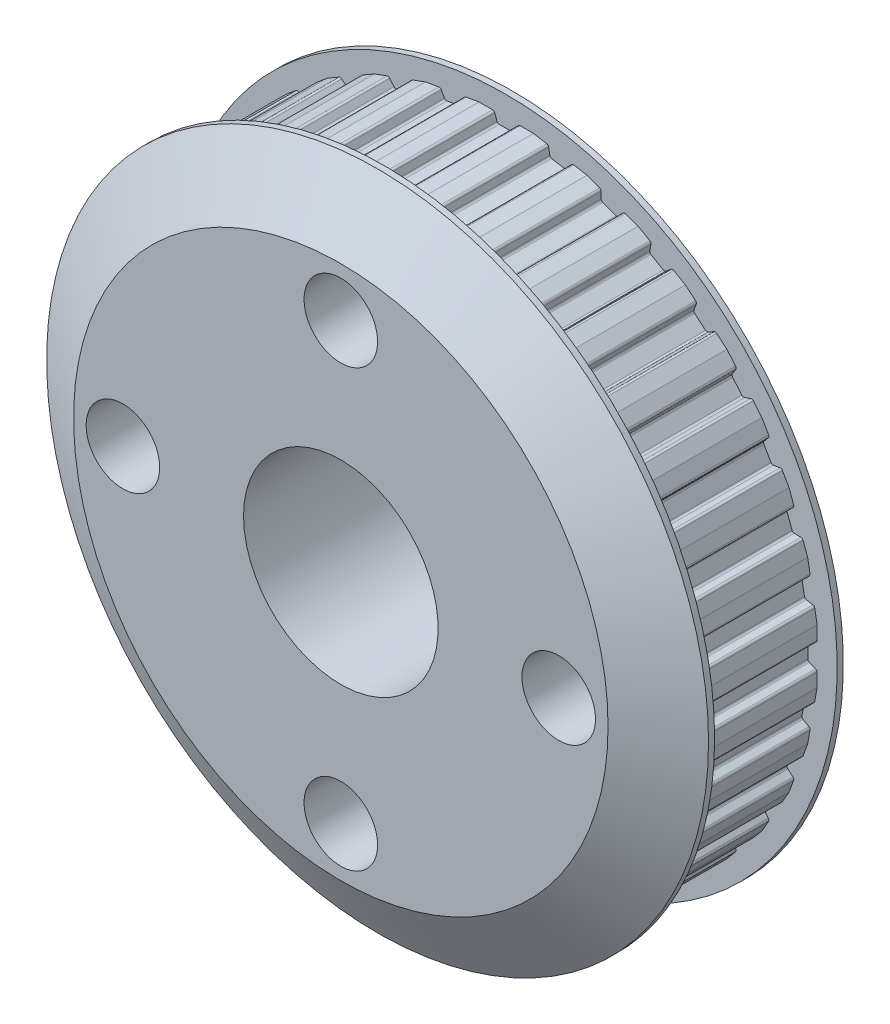
from build123d import *

# Parameters (mm, degrees)
BOSS_EXTRUDE1_DEPTH         = 5
SKETCH3_R                   = 13.5
BOSS_EXTRUDE2_DEPTH         = 1.75
BOSS_EXTRUDE3_START         = 1.75
SKETCH4_R                   = 13.5
BOSS_EXTRUDE3_DEPTH         = 1.75
F_5_16_0_3125_DOWEL_HOLE2_D = 7.9375
F_3_0MM_DOWEL_HOLE1_D       = 3
CIRPATTERN1_COUNT           = 4
CHAMFER1_SIZE               = 1.5
CHAMFER1_SIZE2              = 2.598076211
CHAMFER2_SIZE               = 1.5
CHAMFER2_SIZE2              = 2.598076211


with BuildPart() as part:
    # Sketch1 → Boss-Extrude1 (new body)
    with BuildSketch(Plane.XY):
        with BuildLine():
            Line((-50.893410658, 0.019378156), (-50.349150357, 0.019378156))
            ThreePointArc((-50.349150357, 0.019378156), (-50.294517201, 0.036603923), (-50.259644635, 0.082050737))
            Line((-50.259644635, 0.082050737), (-50.166593884, 0.337705574))
            ThreePointArc((-50.166593884, 0.337705574), (-50.131721317, 0.383152388), (-50.077088162, 0.400378156))
            Line((-50.077088162, 0.400378156), (-49.495946241, 0.400378156))
            ThreePointArc((-49.495946241, 0.400378156), (-49.441313085, 0.383152388), (-49.406440519, 0.337705574))
            Line((-49.406440519, 0.337705574), (-49.313389768, 0.082050737))
            ThreePointArc((-49.313389768, 0.082050737), (-49.278517201, 0.036603923), (-49.223884046, 0.019378156))
            Line((-49.223884046, 0.019378156), (-48.674589342, 0.019378156))
            Line((-48.674589342, 0.019378156), (-48.138597578, 0.113887965))
            ThreePointArc((-48.138597578, 0.113887965), (-48.087785646, 0.140338983), (-48.061334629, 0.191150915))
            Line((-48.061334629, 0.191150915), (-48.014091524, 0.459079874))
            ThreePointArc((-48.014091524, 0.459079874), (-47.987640507, 0.509891806), (-47.936828575, 0.536342823))
            Line((-47.936828575, 0.536342823), (-47.364515506, 0.637257059))
            ThreePointArc((-47.364515506, 0.637257059), (-47.307721127, 0.629779937), (-47.265486597, 0.59107912))
            Line((-47.265486597, 0.59107912), (-47.129455499, 0.355466348))
            ThreePointArc((-47.129455499, 0.355466348), (-47.087220969, 0.316765531), (-47.030426591, 0.309288409))
            Line((-47.030426591, 0.309288409), (-46.489476908, 0.404672434))
            Line((-46.489476908, 0.404672434), (-45.978039519, 0.59082042))
            ThreePointArc((-45.978039519, 0.59082042), (-45.932592706, 0.625692986), (-45.915366938, 0.680326142))
            Line((-45.915366938, 0.680326142), (-45.915366938, 0.952388337))
            ThreePointArc((-45.915366938, 0.952388337), (-45.89814117, 1.007021493), (-45.852694357, 1.041894059))
            Line((-45.852694357, 1.041894059), (-45.306599582, 1.240656302))
            ThreePointArc((-45.306599582, 1.240656302), (-45.24936965, 1.243155015), (-45.20105643, 1.2123761))
            Line((-45.20105643, 1.2123761), (-45.026178222, 1.003964367))
            ThreePointArc((-45.026178222, 1.003964367), (-44.977865003, 0.973185452), (-44.92063507, 0.975684165))
            Line((-44.92063507, 0.975684165), (-44.404466891, 1.163554018))
            Line((-44.404466891, 1.163554018), (-43.933123644, 1.435684168))
            ThreePointArc((-43.933123644, 1.435684168), (-43.894422827, 1.477918699), (-43.886945705, 1.534713077))
            Line((-43.886945705, 1.534713077), (-43.93418881, 1.802642036))
            ThreePointArc((-43.93418881, 1.802642036), (-43.926711688, 1.859436415), (-43.888010871, 1.901670945))
            Line((-43.888010871, 1.901670945), (-43.384727205, 2.192241905))
            ThreePointArc((-43.384727205, 2.192241905), (-43.32880062, 2.204640531), (-43.275876685, 2.182718719))
            Line((-43.275876685, 2.182718719), (-43.067464952, 2.007840511))
            ThreePointArc((-43.067464952, 2.007840511), (-43.014541017, 1.985918699), (-42.958614432, 1.998317324))
            Line((-42.958614432, 1.998317324), (-42.482911265, 2.272964676))
            Line((-42.482911265, 2.272964676), (-42.065983686, 2.622808454))
            ThreePointArc((-42.065983686, 2.622808454), (-42.035204771, 2.671121673), (-42.037703483, 2.728351606))
            Line((-42.037703483, 2.728351606), (-42.130754234, 2.984006443))
            ThreePointArc((-42.130754234, 2.984006443), (-42.133252947, 3.041236376), (-42.102474032, 3.089549595))
            Line((-42.102474032, 3.089549595), (-41.657293493, 3.463100421))
            ThreePointArc((-41.657293493, 3.463100421), (-41.604369558, 3.485022233), (-41.548442973, 3.472623607))
            Line((-41.548442973, 3.472623607), (-41.312830201, 3.33659251))
            ThreePointArc((-41.312830201, 3.33659251), (-41.256903616, 3.324193884), (-41.203979681, 3.346115696))
            Line((-41.203979681, 3.346115696), (-40.783195526, 3.699195526))
            Line((-40.783195526, 3.699195526), (-40.433351748, 4.116123105))
            ThreePointArc((-40.433351748, 4.116123105), (-40.411429936, 4.16904704), (-40.423828561, 4.224973625))
            Line((-40.423828561, 4.224973625), (-40.559859659, 4.460586397))
            ThreePointArc((-40.559859659, 4.460586397), (-40.572258284, 4.516512982), (-40.550336472, 4.569436917))
            Line((-40.550336472, 4.569436917), (-40.176785646, 5.014617456))
            ThreePointArc((-40.176785646, 5.014617456), (-40.128472427, 5.045396371), (-40.071242495, 5.042897658))
            Line((-40.071242495, 5.042897658), (-39.815587657, 4.949846907))
            ThreePointArc((-39.815587657, 4.949846907), (-39.758357725, 4.947348194), (-39.710044505, 4.978127109))
            Line((-39.710044505, 4.978127109), (-39.356964676, 5.398911265))
            Line((-39.356964676, 5.398911265), (-39.084834525, 5.870254512))
            ThreePointArc((-39.084834525, 5.870254512), (-39.0724359, 5.926181096), (-39.094357712, 5.979105032))
            Line((-39.094357712, 5.979105032), (-39.26923592, 6.187516764))
            ThreePointArc((-39.26923592, 6.187516764), (-39.291157732, 6.2404407), (-39.278759107, 6.296367284))
            Line((-39.278759107, 6.296367284), (-38.988188146, 6.799650951))
            ThreePointArc((-38.988188146, 6.799650951), (-38.945953616, 6.838351767), (-38.889159238, 6.845828889))
            Line((-38.889159238, 6.845828889), (-38.621230278, 6.798585785))
            ThreePointArc((-38.621230278, 6.798585785), (-38.5644359, 6.806062906), (-38.52220137, 6.844763723))
            Line((-38.52220137, 6.844763723), (-38.247554018, 7.320466891))
            Line((-38.247554018, 7.320466891), (-38.061406032, 7.831904279))
            ThreePointArc((-38.061406032, 7.831904279), (-38.058907319, 7.889134212), (-38.089686234, 7.937447431))
            Line((-38.089686234, 7.937447431), (-38.298097967, 8.112325639))
            ThreePointArc((-38.298097967, 8.112325639), (-38.328876882, 8.160638859), (-38.326378169, 8.217868791))
            Line((-38.326378169, 8.217868791), (-38.127615926, 8.763963566))
            ThreePointArc((-38.127615926, 8.763963566), (-38.09274336, 8.809410379), (-38.038110204, 8.826636147))
            Line((-38.038110204, 8.826636147), (-37.766048009, 8.826636147))
            ThreePointArc((-37.766048009, 8.826636147), (-37.711414853, 8.843861915), (-37.676542287, 8.889308728))
            Line((-37.676542287, 8.889308728), (-37.488672434, 9.405476908))
            Line((-37.488672434, 9.405476908), (-37.394162624, 9.941468672))
            ThreePointArc((-37.394162624, 9.941468672), (-37.401639746, 9.99826305), (-37.440340563, 10.040497581))
            Line((-37.440340563, 10.040497581), (-37.675953335, 10.176528678))
            ThreePointArc((-37.675953335, 10.176528678), (-37.714654152, 10.218763208), (-37.722131274, 10.275557587))
            Line((-37.722131274, 10.275557587), (-37.621217038, 10.847870656))
            ThreePointArc((-37.621217038, 10.847870656), (-37.594766021, 10.898682588), (-37.543954089, 10.925133605))
            Line((-37.543954089, 10.925133605), (-37.276025129, 10.97237671))
            ThreePointArc((-37.276025129, 10.97237671), (-37.225213197, 10.998827727), (-37.19876218, 11.049639659))
            Line((-37.19876218, 11.049639659), (-37.103378156, 11.590589342))
            Line((-37.103378156, 11.590589342), (-37.103378156, 12.134849643))
            ThreePointArc((-37.103378156, 12.134849643), (-37.120603923, 12.189482799), (-37.166050737, 12.224355365))
            Line((-37.166050737, 12.224355365), (-37.421705574, 12.317406116))
            ThreePointArc((-37.421705574, 12.317406116), (-37.467152388, 12.352278683), (-37.484378156, 12.406911838))
            Line((-37.484378156, 12.406911838), (-37.484378156, 12.988053759))
            ThreePointArc((-37.484378156, 12.988053759), (-37.467152388, 13.042686915), (-37.421705574, 13.077559481))
            Line((-37.421705574, 13.077559481), (-37.166050737, 13.170610232))
            ThreePointArc((-37.166050737, 13.170610232), (-37.120603923, 13.205482799), (-37.103378156, 13.260115954))
            Line((-37.103378156, 13.260115954), (-37.103378156, 13.809410658))
            Line((-37.103378156, 13.809410658), (-37.197887965, 14.345402422))
            ThreePointArc((-37.197887965, 14.345402422), (-37.224338983, 14.396214354), (-37.275150915, 14.422665371))
            Line((-37.275150915, 14.422665371), (-37.543079874, 14.469908476))
            ThreePointArc((-37.543079874, 14.469908476), (-37.593891806, 14.496359493), (-37.620342823, 14.547171425))
            Line((-37.620342823, 14.547171425), (-37.721257059, 15.119484494))
            ThreePointArc((-37.721257059, 15.119484494), (-37.713779937, 15.176278873), (-37.67507912, 15.218513403))
            Line((-37.67507912, 15.218513403), (-37.439466348, 15.354544501))
            ThreePointArc((-37.439466348, 15.354544501), (-37.400765531, 15.396779031), (-37.393288409, 15.453573409))
            Line((-37.393288409, 15.453573409), (-37.488672434, 15.994523092))
            Line((-37.488672434, 15.994523092), (-37.67482042, 16.505960481))
            ThreePointArc((-37.67482042, 16.505960481), (-37.709692986, 16.551407294), (-37.764326142, 16.568633062))
            Line((-37.764326142, 16.568633062), (-38.036388337, 16.568633062))
            ThreePointArc((-38.036388337, 16.568633062), (-38.091021493, 16.58585883), (-38.125894059, 16.631305643))
            Line((-38.125894059, 16.631305643), (-38.324656302, 17.177400418))
            ThreePointArc((-38.324656302, 17.177400418), (-38.327155015, 17.23463035), (-38.2963761, 17.28294357))
            Line((-38.2963761, 17.28294357), (-38.087964367, 17.457821778))
            ThreePointArc((-38.087964367, 17.457821778), (-38.057185452, 17.506134997), (-38.059684165, 17.56336493))
            Line((-38.059684165, 17.56336493), (-38.247554018, 18.079533109))
            Line((-38.247554018, 18.079533109), (-38.519684168, 18.550876356))
            ThreePointArc((-38.519684168, 18.550876356), (-38.561918699, 18.589577173), (-38.618713077, 18.597054295))
            Line((-38.618713077, 18.597054295), (-38.886642036, 18.54981119))
            ThreePointArc((-38.886642036, 18.54981119), (-38.943436415, 18.557288312), (-38.985670945, 18.595989129))
            Line((-38.985670945, 18.595989129), (-39.276241905, 19.099272795))
            ThreePointArc((-39.276241905, 19.099272795), (-39.288640531, 19.15519938), (-39.266718719, 19.208123315))
            Line((-39.266718719, 19.208123315), (-39.091840511, 19.416535048))
            ThreePointArc((-39.091840511, 19.416535048), (-39.069918699, 19.469458983), (-39.082317324, 19.525385568))
            Line((-39.082317324, 19.525385568), (-39.356964676, 20.001088735))
            Line((-39.356964676, 20.001088735), (-39.706808454, 20.418016314))
            ThreePointArc((-39.706808454, 20.418016314), (-39.755121673, 20.448795229), (-39.812351606, 20.446296517))
            Line((-39.812351606, 20.446296517), (-40.068006443, 20.353245766))
            ThreePointArc((-40.068006443, 20.353245766), (-40.125236376, 20.350747053), (-40.173549595, 20.381525968))
            Line((-40.173549595, 20.381525968), (-40.547100421, 20.826706507))
            ThreePointArc((-40.547100421, 20.826706507), (-40.569022233, 20.879630442), (-40.556623607, 20.935557027))
            Line((-40.556623607, 20.935557027), (-40.42059251, 21.171169799))
            ThreePointArc((-40.42059251, 21.171169799), (-40.408193884, 21.227096384), (-40.430115696, 21.280020319))
            Line((-40.430115696, 21.280020319), (-40.783195526, 21.700804474))
            Line((-40.783195526, 21.700804474), (-41.200123105, 22.050648252))
            ThreePointArc((-41.200123105, 22.050648252), (-41.25304704, 22.072570064), (-41.308973625, 22.060171439))
            Line((-41.308973625, 22.060171439), (-41.544586397, 21.924140341))
            ThreePointArc((-41.544586397, 21.924140341), (-41.600512982, 21.911741716), (-41.653436917, 21.933663528))
            Line((-41.653436917, 21.933663528), (-42.098617456, 22.307214354))
            ThreePointArc((-42.098617456, 22.307214354), (-42.129396371, 22.355527573), (-42.126897658, 22.412757505))
            Line((-42.126897658, 22.412757505), (-42.033846907, 22.668412343))
            ThreePointArc((-42.033846907, 22.668412343), (-42.031348194, 22.725642275), (-42.062127109, 22.773955495))
            Line((-42.062127109, 22.773955495), (-42.482911265, 23.127035324))
            Line((-42.482911265, 23.127035324), (-42.954254512, 23.399165475))
            ThreePointArc((-42.954254512, 23.399165475), (-43.010181096, 23.4115641), (-43.063105032, 23.389642288))
            Line((-43.063105032, 23.389642288), (-43.271516764, 23.21476408))
            ThreePointArc((-43.271516764, 23.21476408), (-43.3244407, 23.192842268), (-43.380367284, 23.205240893))
            Line((-43.380367284, 23.205240893), (-43.883650951, 23.495811854))
            ThreePointArc((-43.883650951, 23.495811854), (-43.922351767, 23.538046384), (-43.929828889, 23.594840762))
            Line((-43.929828889, 23.594840762), (-43.882585785, 23.862769722))
            ThreePointArc((-43.882585785, 23.862769722), (-43.890062906, 23.9195641), (-43.928763723, 23.96179863))
            Line((-43.928763723, 23.96179863), (-44.404466891, 24.236445982))
            Line((-44.404466891, 24.236445982), (-44.915904279, 24.422593968))
            ThreePointArc((-44.915904279, 24.422593968), (-44.973134212, 24.425092681), (-45.021447431, 24.394313766))
            Line((-45.021447431, 24.394313766), (-45.196325639, 24.185902033))
            ThreePointArc((-45.196325639, 24.185902033), (-45.244638859, 24.155123118), (-45.301868791, 24.157621831))
            Line((-45.301868791, 24.157621831), (-45.847963566, 24.356384074))
            ThreePointArc((-45.847963566, 24.356384074), (-45.893410379, 24.39125664), (-45.910636147, 24.445889796))
            Line((-45.910636147, 24.445889796), (-45.910636147, 24.717951991))
            ThreePointArc((-45.910636147, 24.717951991), (-45.927861915, 24.772585147), (-45.973308728, 24.807457713))
            Line((-45.973308728, 24.807457713), (-46.489476908, 24.995327566))
            Line((-46.489476908, 24.995327566), (-47.025468672, 25.089837376))
            ThreePointArc((-47.025468672, 25.089837376), (-47.08226305, 25.082360254), (-47.124497581, 25.043659437))
            Line((-47.124497581, 25.043659437), (-47.260528678, 24.808046665))
            ThreePointArc((-47.260528678, 24.808046665), (-47.302763208, 24.769345848), (-47.359557587, 24.761868726))
            Line((-47.359557587, 24.761868726), (-47.931870656, 24.862782962))
            ThreePointArc((-47.931870656, 24.862782962), (-47.982682588, 24.889233979), (-48.009133605, 24.940045911))
            Line((-48.009133605, 24.940045911), (-48.05637671, 25.207974871))
            ThreePointArc((-48.05637671, 25.207974871), (-48.082827727, 25.258786803), (-48.133639659, 25.28523782))
            Line((-48.133639659, 25.28523782), (-48.674589342, 25.380621844))
            Line((-48.674589342, 25.380621844), (-49.218849643, 25.380621844))
            ThreePointArc((-49.218849643, 25.380621844), (-49.273482799, 25.363396077), (-49.308355365, 25.317949263))
            Line((-49.308355365, 25.317949263), (-49.401406116, 25.062294426))
            ThreePointArc((-49.401406116, 25.062294426), (-49.436278683, 25.016847612), (-49.490911838, 24.999621844))
            Line((-49.490911838, 24.999621844), (-50.072053759, 24.999621844))
            ThreePointArc((-50.072053759, 24.999621844), (-50.126686915, 25.016847612), (-50.161559481, 25.062294426))
            Line((-50.161559481, 25.062294426), (-50.254610232, 25.317949263))
            ThreePointArc((-50.254610232, 25.317949263), (-50.289482799, 25.363396077), (-50.344115954, 25.380621844))
            Line((-50.344115954, 25.380621844), (-50.893410658, 25.380621844))
            Line((-50.893410658, 25.380621844), (-51.429402422, 25.286112035))
            ThreePointArc((-51.429402422, 25.286112035), (-51.480214354, 25.259661017), (-51.506665371, 25.208849085))
            Line((-51.506665371, 25.208849085), (-51.553908476, 24.940920126))
            ThreePointArc((-51.553908476, 24.940920126), (-51.580359493, 24.890108194), (-51.631171425, 24.863657177))
            Line((-51.631171425, 24.863657177), (-52.203484494, 24.762742941))
            ThreePointArc((-52.203484494, 24.762742941), (-52.260278873, 24.770220063), (-52.302513403, 24.80892088))
            Line((-52.302513403, 24.80892088), (-52.438544501, 25.044533652))
            ThreePointArc((-52.438544501, 25.044533652), (-52.480779031, 25.083234469), (-52.537573409, 25.090711591))
            Line((-52.537573409, 25.090711591), (-53.078523092, 24.995327566))
            Line((-53.078523092, 24.995327566), (-53.589960481, 24.80917958))
            ThreePointArc((-53.589960481, 24.80917958), (-53.635407294, 24.774307014), (-53.652633062, 24.719673858))
            Line((-53.652633062, 24.719673858), (-53.652633062, 24.447611663))
            ThreePointArc((-53.652633062, 24.447611663), (-53.66985883, 24.392978507), (-53.715305643, 24.358105941))
            Line((-53.715305643, 24.358105941), (-54.261400418, 24.159343698))
            ThreePointArc((-54.261400418, 24.159343698), (-54.31863035, 24.156844985), (-54.36694357, 24.1876239))
            Line((-54.36694357, 24.1876239), (-54.541821778, 24.396035633))
            ThreePointArc((-54.541821778, 24.396035633), (-54.590134997, 24.426814548), (-54.64736493, 24.424315835))
            Line((-54.64736493, 24.424315835), (-55.163533109, 24.236445982))
            Line((-55.163533109, 24.236445982), (-55.634876356, 23.964315832))
            ThreePointArc((-55.634876356, 23.964315832), (-55.673577173, 23.922081301), (-55.681054295, 23.865286923))
            Line((-55.681054295, 23.865286923), (-55.63381119, 23.597357964))
            ThreePointArc((-55.63381119, 23.597357964), (-55.641288312, 23.540563585), (-55.679989129, 23.498329055))
            Line((-55.679989129, 23.498329055), (-56.183272795, 23.207758095))
            ThreePointArc((-56.183272795, 23.207758095), (-56.23919938, 23.195359469), (-56.292123315, 23.217281281))
            Line((-56.292123315, 23.217281281), (-56.500535048, 23.392159489))
            ThreePointArc((-56.500535048, 23.392159489), (-56.553458983, 23.414081301), (-56.609385568, 23.401682676))
            Line((-56.609385568, 23.401682676), (-57.085088735, 23.127035324))
            Line((-57.085088735, 23.127035324), (-57.502016314, 22.777191546))
            ThreePointArc((-57.502016314, 22.777191546), (-57.532795229, 22.728878327), (-57.530296517, 22.671648394))
            Line((-57.530296517, 22.671648394), (-57.437245766, 22.415993557))
            ThreePointArc((-57.437245766, 22.415993557), (-57.434747053, 22.358763624), (-57.465525968, 22.310450405))
            Line((-57.465525968, 22.310450405), (-57.910706507, 21.936899579))
            ThreePointArc((-57.910706507, 21.936899579), (-57.963630442, 21.914977767), (-58.019557027, 21.927376393))
            Line((-58.019557027, 21.927376393), (-58.255169799, 22.06340749))
            ThreePointArc((-58.255169799, 22.06340749), (-58.311096384, 22.075806116), (-58.364020319, 22.053884304))
            Line((-58.364020319, 22.053884304), (-58.784804474, 21.700804474))
            Line((-58.784804474, 21.700804474), (-59.134648252, 21.283876895))
            ThreePointArc((-59.134648252, 21.283876895), (-59.156570064, 21.23095296), (-59.144171439, 21.175026375))
            Line((-59.144171439, 21.175026375), (-59.008140341, 20.939413603))
            ThreePointArc((-59.008140341, 20.939413603), (-58.995741716, 20.883487018), (-59.017663528, 20.830563083))
            Line((-59.017663528, 20.830563083), (-59.391214354, 20.385382544))
            ThreePointArc((-59.391214354, 20.385382544), (-59.439527573, 20.354603629), (-59.496757505, 20.357102342))
            Line((-59.496757505, 20.357102342), (-59.752412343, 20.450153093))
            ThreePointArc((-59.752412343, 20.450153093), (-59.809642275, 20.452651806), (-59.857955495, 20.421872891))
            Line((-59.857955495, 20.421872891), (-60.211035324, 20.001088735))
            Line((-60.211035324, 20.001088735), (-60.483165475, 19.529745488))
            ThreePointArc((-60.483165475, 19.529745488), (-60.4955641, 19.473818904), (-60.473642288, 19.420894968))
            Line((-60.473642288, 19.420894968), (-60.29876408, 19.212483236))
            ThreePointArc((-60.29876408, 19.212483236), (-60.276842268, 19.1595593), (-60.289240893, 19.103632716))
            Line((-60.289240893, 19.103632716), (-60.579811854, 18.600349049))
            ThreePointArc((-60.579811854, 18.600349049), (-60.622046384, 18.561648233), (-60.678840762, 18.554171111))
            Line((-60.678840762, 18.554171111), (-60.946769722, 18.601414215))
            ThreePointArc((-60.946769722, 18.601414215), (-61.0035641, 18.593937094), (-61.04579863, 18.555236277))
            Line((-61.04579863, 18.555236277), (-61.320445982, 18.079533109))
            Line((-61.320445982, 18.079533109), (-61.506593968, 17.568095721))
            ThreePointArc((-61.506593968, 17.568095721), (-61.509092681, 17.510865788), (-61.478313766, 17.462552569))
            Line((-61.478313766, 17.462552569), (-61.269902033, 17.287674361))
            ThreePointArc((-61.269902033, 17.287674361), (-61.239123118, 17.239361141), (-61.241621831, 17.182131209))
            Line((-61.241621831, 17.182131209), (-61.440384074, 16.636036434))
            ThreePointArc((-61.440384074, 16.636036434), (-61.47525664, 16.590589621), (-61.529889796, 16.573363853))
            Line((-61.529889796, 16.573363853), (-61.801951991, 16.573363853))
            ThreePointArc((-61.801951991, 16.573363853), (-61.856585147, 16.556138085), (-61.891457713, 16.510691272))
            Line((-61.891457713, 16.510691272), (-62.079327566, 15.994523092))
            Line((-62.079327566, 15.994523092), (-62.173837376, 15.458531328))
            ThreePointArc((-62.173837376, 15.458531328), (-62.166360254, 15.40173695), (-62.127659437, 15.359502419))
            Line((-62.127659437, 15.359502419), (-61.892046665, 15.223471322))
            ThreePointArc((-61.892046665, 15.223471322), (-61.853345848, 15.181236792), (-61.845868726, 15.124442413))
            Line((-61.845868726, 15.124442413), (-61.946782962, 14.552129344))
            ThreePointArc((-61.946782962, 14.552129344), (-61.973233979, 14.501317412), (-62.024045911, 14.474866395))
            Line((-62.024045911, 14.474866395), (-62.291974871, 14.42762329))
            ThreePointArc((-62.291974871, 14.42762329), (-62.342786803, 14.401172273), (-62.36923782, 14.350360341))
            Line((-62.36923782, 14.350360341), (-62.464621844, 13.809410658))
            Line((-62.464621844, 13.809410658), (-62.464621844, 13.265150357))
            ThreePointArc((-62.464621844, 13.265150357), (-62.447396077, 13.210517201), (-62.401949263, 13.175644635))
            Line((-62.401949263, 13.175644635), (-62.146294426, 13.082593884))
            ThreePointArc((-62.146294426, 13.082593884), (-62.100847612, 13.047721317), (-62.083621844, 12.993088162))
            Line((-62.083621844, 12.993088162), (-62.083621844, 12.411946241))
            ThreePointArc((-62.083621844, 12.411946241), (-62.100847612, 12.357313085), (-62.146294426, 12.322440519))
            Line((-62.146294426, 12.322440519), (-62.401949263, 12.229389768))
            ThreePointArc((-62.401949263, 12.229389768), (-62.447396077, 12.194517201), (-62.464621844, 12.139884046))
            Line((-62.464621844, 12.139884046), (-62.464621844, 11.590589342))
            Line((-62.464621844, 11.590589342), (-62.370112035, 11.054597578))
            ThreePointArc((-62.370112035, 11.054597578), (-62.343661017, 11.003785646), (-62.292849085, 10.977334629))
            Line((-62.292849085, 10.977334629), (-62.024920126, 10.930091524))
            ThreePointArc((-62.024920126, 10.930091524), (-61.974108194, 10.903640507), (-61.947657177, 10.852828575))
            Line((-61.947657177, 10.852828575), (-61.846742941, 10.280515506))
            ThreePointArc((-61.846742941, 10.280515506), (-61.854220063, 10.223721127), (-61.89292088, 10.181486597))
            Line((-61.89292088, 10.181486597), (-62.128533652, 10.045455499))
            ThreePointArc((-62.128533652, 10.045455499), (-62.167234469, 10.003220969), (-62.174711591, 9.946426591))
            Line((-62.174711591, 9.946426591), (-62.079327566, 9.405476908))
            Line((-62.079327566, 9.405476908), (-61.89317958, 8.894039519))
            ThreePointArc((-61.89317958, 8.894039519), (-61.858307014, 8.848592706), (-61.803673858, 8.831366938))
            Line((-61.803673858, 8.831366938), (-61.531611663, 8.831366938))
            ThreePointArc((-61.531611663, 8.831366938), (-61.476978507, 8.81414117), (-61.442105941, 8.768694357))
            Line((-61.442105941, 8.768694357), (-61.243343698, 8.222599582))
            ThreePointArc((-61.243343698, 8.222599582), (-61.240844985, 8.16536965), (-61.2716239, 8.11705643))
            Line((-61.2716239, 8.11705643), (-61.480035633, 7.942178222))
            ThreePointArc((-61.480035633, 7.942178222), (-61.510814548, 7.893865003), (-61.508315835, 7.83663507))
            Line((-61.508315835, 7.83663507), (-61.320445982, 7.320466891))
            Line((-61.320445982, 7.320466891), (-61.048315832, 6.849123644))
            ThreePointArc((-61.048315832, 6.849123644), (-61.006081301, 6.810422827), (-60.949286923, 6.802945705))
            Line((-60.949286923, 6.802945705), (-60.681357964, 6.85018881))
            ThreePointArc((-60.681357964, 6.85018881), (-60.624563585, 6.842711688), (-60.582329055, 6.804010871))
            Line((-60.582329055, 6.804010871), (-60.291758095, 6.300727205))
            ThreePointArc((-60.291758095, 6.300727205), (-60.279359469, 6.24480062), (-60.301281281, 6.191876685))
            Line((-60.301281281, 6.191876685), (-60.476159489, 5.983464952))
            ThreePointArc((-60.476159489, 5.983464952), (-60.498081301, 5.930541017), (-60.485682676, 5.874614432))
            Line((-60.485682676, 5.874614432), (-60.211035324, 5.398911265))
            Line((-60.211035324, 5.398911265), (-59.861191546, 4.981983686))
            ThreePointArc((-59.861191546, 4.981983686), (-59.812878327, 4.951204771), (-59.755648394, 4.953703483))
            Line((-59.755648394, 4.953703483), (-59.499993557, 5.046754234))
            ThreePointArc((-59.499993557, 5.046754234), (-59.442763624, 5.049252947), (-59.394450405, 5.018474032))
            Line((-59.394450405, 5.018474032), (-59.020899579, 4.573293493))
            ThreePointArc((-59.020899579, 4.573293493), (-58.998977767, 4.520369558), (-59.011376393, 4.464442973))
            Line((-59.011376393, 4.464442973), (-59.14740749, 4.228830201))
            ThreePointArc((-59.14740749, 4.228830201), (-59.159806116, 4.172903616), (-59.137884304, 4.119979681))
            Line((-59.137884304, 4.119979681), (-58.784804474, 3.699195526))
            Line((-58.784804474, 3.699195526), (-58.367876895, 3.349351748))
            ThreePointArc((-58.367876895, 3.349351748), (-58.31495296, 3.327429936), (-58.259026375, 3.339828561))
            Line((-58.259026375, 3.339828561), (-58.023413603, 3.475859659))
            ThreePointArc((-58.023413603, 3.475859659), (-57.967487018, 3.488258284), (-57.914563083, 3.466336472))
            Line((-57.914563083, 3.466336472), (-57.469382544, 3.092785646))
            ThreePointArc((-57.469382544, 3.092785646), (-57.438603629, 3.044472427), (-57.441102342, 2.987242495))
            Line((-57.441102342, 2.987242495), (-57.534153093, 2.731587657))
            ThreePointArc((-57.534153093, 2.731587657), (-57.536651806, 2.674357725), (-57.505872891, 2.626044505))
            Line((-57.505872891, 2.626044505), (-57.085088735, 2.272964676))
            Line((-57.085088735, 2.272964676), (-56.613745488, 2.000834525))
            ThreePointArc((-56.613745488, 2.000834525), (-56.557818904, 1.9884359), (-56.504894968, 2.010357712))
            Line((-56.504894968, 2.010357712), (-56.296483236, 2.18523592))
            ThreePointArc((-56.296483236, 2.18523592), (-56.2435593, 2.207157732), (-56.187632716, 2.194759107))
            Line((-56.187632716, 2.194759107), (-55.684349049, 1.904188146))
            ThreePointArc((-55.684349049, 1.904188146), (-55.645648233, 1.861953616), (-55.638171111, 1.805159238))
            Line((-55.638171111, 1.805159238), (-55.685414215, 1.537230278))
            ThreePointArc((-55.685414215, 1.537230278), (-55.677937094, 1.4804359), (-55.639236277, 1.43820137))
            Line((-55.639236277, 1.43820137), (-55.163533109, 1.163554018))
            Line((-55.163533109, 1.163554018), (-54.652095721, 0.977406032))
            ThreePointArc((-54.652095721, 0.977406032), (-54.594865788, 0.974907319), (-54.546552569, 1.005686234))
            Line((-54.546552569, 1.005686234), (-54.371674361, 1.214097967))
            ThreePointArc((-54.371674361, 1.214097967), (-54.323361141, 1.244876882), (-54.266131209, 1.242378169))
            Line((-54.266131209, 1.242378169), (-53.720036434, 1.043615926))
            ThreePointArc((-53.720036434, 1.043615926), (-53.674589621, 1.00874336), (-53.657363853, 0.954110204))
            Line((-53.657363853, 0.954110204), (-53.657363853, 0.682048009))
            ThreePointArc((-53.657363853, 0.682048009), (-53.640138085, 0.627414853), (-53.594691272, 0.592542287))
            Line((-53.594691272, 0.592542287), (-53.078523092, 0.404672434))
            Line((-53.078523092, 0.404672434), (-52.542531328, 0.310162624))
            ThreePointArc((-52.542531328, 0.310162624), (-52.48573695, 0.317639746), (-52.443502419, 0.356340563))
            Line((-52.443502419, 0.356340563), (-52.307471322, 0.591953335))
            ThreePointArc((-52.307471322, 0.591953335), (-52.265236792, 0.630654152), (-52.208442413, 0.638131274))
            Line((-52.208442413, 0.638131274), (-51.636129344, 0.537217038))
            ThreePointArc((-51.636129344, 0.537217038), (-51.585317412, 0.510766021), (-51.558866395, 0.459954089))
            Line((-51.558866395, 0.459954089), (-51.51162329, 0.192025129))
            ThreePointArc((-51.51162329, 0.192025129), (-51.485172273, 0.141213197), (-51.434360341, 0.11476218))
            Line((-51.434360341, 0.11476218), (-50.893410658, 0.019378156))
        make_face()
    extrude(amount=BOSS_EXTRUDE1_DEPTH)

    # Sketch3 → Boss-Extrude2 (add)
    with BuildSketch(Plane.XY.offset(5)):
        with Locations((-49.784, 12.7)):
            Circle(SKETCH3_R)
    extrude(amount=BOSS_EXTRUDE2_DEPTH)

    # Sketch4 → Boss-Extrude3 (add)
    with BuildSketch(Plane(origin=(0, 0, 0), x_dir=(-1, 0, 0), z_dir=(0, 0, -1)).offset(BOSS_EXTRUDE3_START)):
        with Locations((49.784, 12.7)):
            Circle(SKETCH4_R)
    extrude(amount=-BOSS_EXTRUDE3_DEPTH)

    # 5/16 (0.3125) Dowel Hole2 (through all)
    with Locations(Plane(origin=(0, 0, -1.75), x_dir=(-1, 0, 0), z_dir=(0, 0, -1))):
        with Locations((49.784, 12.7)):
            Hole(F_5_16_0_3125_DOWEL_HOLE2_D / 2)

    # Ø3.0mm Dowel Hole1 (through all)
    with Locations(Plane(origin=(0, 0, -1.75), x_dir=(-1, 0, 0), z_dir=(0, 0, -1))):
        with Locations((49.784, 3.81), (49.784, 12.7)):
            f_3_0mm_dowel_hole1 = Hole(F_3_0MM_DOWEL_HOLE1_D / 2)

    # CirPattern1: Ø3.0mm Dowel Hole1 ×4 about axis
    cirpattern1_axis = Axis((-49.784, 12.7, 6.75), (0, 0, -1))
    for i in range(1, CIRPATTERN1_COUNT):
        add(f_3_0mm_dowel_hole1.rotate(cirpattern1_axis, i * 360 / CIRPATTERN1_COUNT), mode=Mode.SUBTRACT)

    # Chamfer1
    chamfer1_edges = [part.edges().sort_by_distance(p)[0] for p in [
        (-63.284, 12.7, 6.75),
    ]]
    chamfer1_side = [part.faces().sort_by_distance(p)[0] for p in [
        (-63.284, 12.7, 5.875),
    ]]
    chamfer(chamfer1_edges, length=CHAMFER1_SIZE, length2=CHAMFER1_SIZE2, reference=chamfer1_side[0])

    # Chamfer2
    chamfer2_edges = [part.edges().sort_by_distance(p)[0] for p in [
        (-36.284, 12.7, -1.75),
    ]]
    chamfer2_side = [part.faces().sort_by_distance(p)[0] for p in [
        (-36.284, 12.7, -0.875),
    ]]
    chamfer(chamfer2_edges, length=CHAMFER2_SIZE, length2=CHAMFER2_SIZE2, reference=chamfer2_side[0])


solid = part.part
